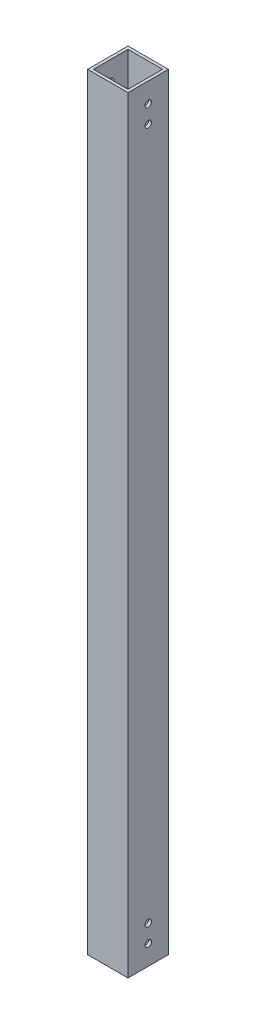
from build123d import *

# Parameters (mm, degrees)
SKETCH1_W               = 44.45
SKETCH1_H               = 44.45
SKETCH1_W_2             = 38.1
SKETCH1_H_2             = 38.1
BOSS_EXTRUDE1_DEPTH     = 844.55
F_1_4_CLEARANCE_HOLE1_D = 7.14248


with BuildPart() as part:
    # Sketch1 → Boss-Extrude1 (new body)
    with BuildSketch(Plane(origin=(0, 0, 0), x_dir=(1, 0, 0), z_dir=(0, 1, 0))):
        Rectangle(SKETCH1_W, SKETCH1_H)
        Rectangle(SKETCH1_W_2, SKETCH1_H_2, mode=Mode.SUBTRACT)
    extrude(amount=BOSS_EXTRUDE1_DEPTH)

    # 1/4 Clearance Hole1 (through all)
    with Locations(Plane.ZY.offset(22.225)):
        with Locations((0, 803.275), (0, 41.275), (0, 822.721875), (0, 21.828125)):
            Hole(F_1_4_CLEARANCE_HOLE1_D / 2)


solid = part.part
